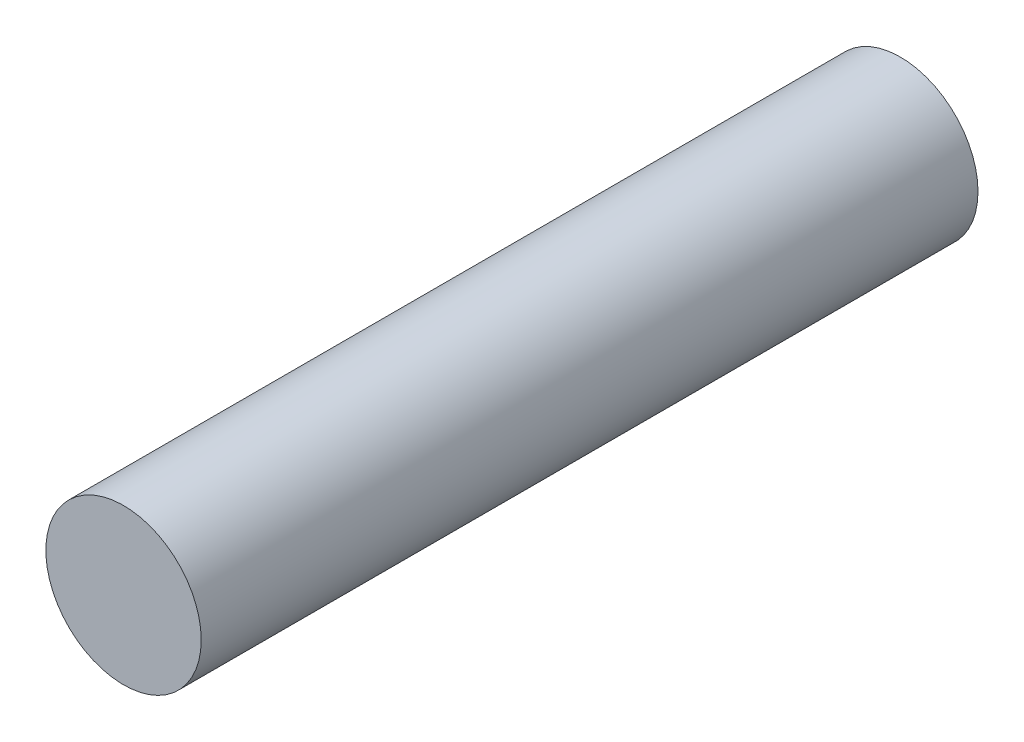
from build123d import *

# Parameters (mm, degrees)
SKETCH1_R           = 1
BOSS_EXTRUDE1_DEPTH = 5


with BuildPart() as part:
    # Sketch1 → Boss-Extrude1 (new, symmetric)
    with BuildSketch(Plane.XY):
        Circle(SKETCH1_R)
    extrude(amount=BOSS_EXTRUDE1_DEPTH, both=True)


solid = part.part
